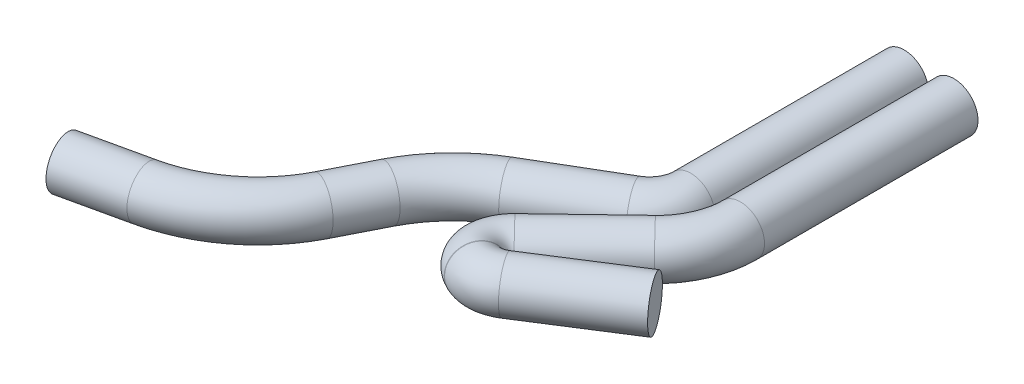
from build123d import *

# Parameters (mm, degrees)
BOSS_EXTRU_1_DEPTH        = 5
BOSS_EXTRU_1_DEPTH_BACK   = 10
ESQUISSE1_R               = 1.75
BOSS_EXTRU_1_2_DEPTH      = 5
BOSS_EXTRU_1_2_DEPTH_BACK = 10
ESQUISSE2_R               = 1.75
ESQUISSE3_R               = 1.75
ENL_V_MAT_EXTRU_1_DEPTH   = 3
ESQUISSE4_R               = 1.75
ESQUISSE5_R               = 1.75
ENL_V_MAT_EXTRU_2_DEPTH   = 3


with BuildPart() as part:
    # Esquisse1 → Boss.-Extru.1 (new, two sides: drawn at the far end of the back side and taken through both)
    with BuildSketch(Plane.XY.offset(-BOSS_EXTRU_1_DEPTH_BACK)):
        with Locations((-1.8, 0)):
            Circle(ESQUISSE1_R)
    extrude(amount=BOSS_EXTRU_1_DEPTH + BOSS_EXTRU_1_DEPTH_BACK)



with BuildPart() as body_2:
    # Esquisse1 → Boss.-Extru.1 2 (new, two sides: drawn at the far end of the back side and taken through both)
    with BuildSketch(Plane.XY.offset(-BOSS_EXTRU_1_2_DEPTH_BACK)):
        with Locations((1.8, 0)):
            Circle(ESQUISSE1_R)
    extrude(amount=BOSS_EXTRU_1_2_DEPTH + BOSS_EXTRU_1_2_DEPTH_BACK)

    # Balayage1: sweep along a curve in space
    with BuildLine() as balayage1_path:
        Line((1.8, 0, 5.5), (1.8, 0, 5))
        ThreePointArc((-0.050422137, 0, 9.833705523), (1.318037114, 0, 7.856112563), (1.8, 0, 5.5))
        Line((-0.050422137, 0, 9.833705523), (-5.259213711, 0, 14.821189351))
        ThreePointArc((-4.816825334, 0.348555806, 18.022401208), (-5.861081542, 0.11010529, 16.542524811), (-5.259213711, 0, 14.821189351))
        Line((-4.816825334, 0.348555806, 18.022401208), (-4.769816548, 0.355226106, 18.046757443))
        ThreePointArc((-2.772717213, 0.5, 17.953095794), (-3.761180865, 0.461194336, 18.266892532), (-4.769816548, 0.355226106, 18.046757443))
        Line((6.371171623, 0.5, 12.127796149), (-2.772717213, 0.5, 17.953095794))
    # Esquisse2 → Balayage1 (sweep)
    with BuildSketch(Plane.XY.offset(5)):
        with Locations((1.8, 0)):
            Circle(ESQUISSE2_R)
    sweep(path=balayage1_path.line)

    # Esquisse3 → Enlèv. mat.-Extru.1 (cut)
    with BuildSketch(Plane(origin=(-0.963885494, 0, 0.614062783), x_dir=(-0.5372996083468307, 1.153766929709301e-15, -0.8433914458128813), z_dir=(0.8433914458128813, -1.8110513089197862e-15, -0.5372996083468307))):
        with Locations((-13.651707546, 0.5)):
            Circle(ESQUISSE3_R)
    extrude(amount=-ENL_V_MAT_EXTRU_1_DEPTH, mode=Mode.SUBTRACT)


with BuildPart() as part_1:
    add(part.part)

    add(body_2.part)  # Balayage2 merges body 2
    # Balayage2: sweep along a curve in space
    with BuildLine() as balayage2_path:
        Line((-1.8, 0, 5), (-1.8, 0, 5.5))
        ThreePointArc((-3.277669531, 0, 8.085055114), (-2.195485515, 0, 6.988792899), (-1.8, 0, 5.5))
        Line((-3.277669531, 0, 8.085055114), (-9.10744265, 0, 11.518189362))
        ThreePointArc((-13.19492784, 0.134768754, 16.117942999), (-11.513609411, 0.034530095, 13.496967314), (-9.10744265, 0, 11.518189362))
        Line((-14.679034762, 0.288575292, 19.494314724), (-13.19492784, 0.134768754, 16.117942999))
        ThreePointArc((-21.673024109, 0.5, 25.233780857), (-17.489247519, 0.444119723, 23.199109722), (-14.679034762, 0.288575292, 19.494314724))
        Line((-29.410957851, 0.5, 26.949239467), (-21.673024109, 0.5, 25.233780857))
    # Esquisse4 → Balayage2 (sweep)
    with BuildSketch(Plane.XY.offset(5)):
        with Locations((-1.8, 0)):
            Circle(ESQUISSE4_R)
    sweep(path=balayage2_path.line)

    # Esquisse5 → Enlèv. mat.-Extru.2 (cut)
    with BuildSketch(Plane(origin=(-33.727789357, 0, 7.477270883), x_dir=(0.21643961393810765, 0, 0.9762960071199323), z_dir=(-0.9762960071199324, 0, 0.21643961393810768))):
        with Locations((19.944738524, 0.5)):
            Circle(ESQUISSE5_R)
    extrude(amount=-ENL_V_MAT_EXTRU_2_DEPTH, mode=Mode.SUBTRACT)


solid = part_1.part
